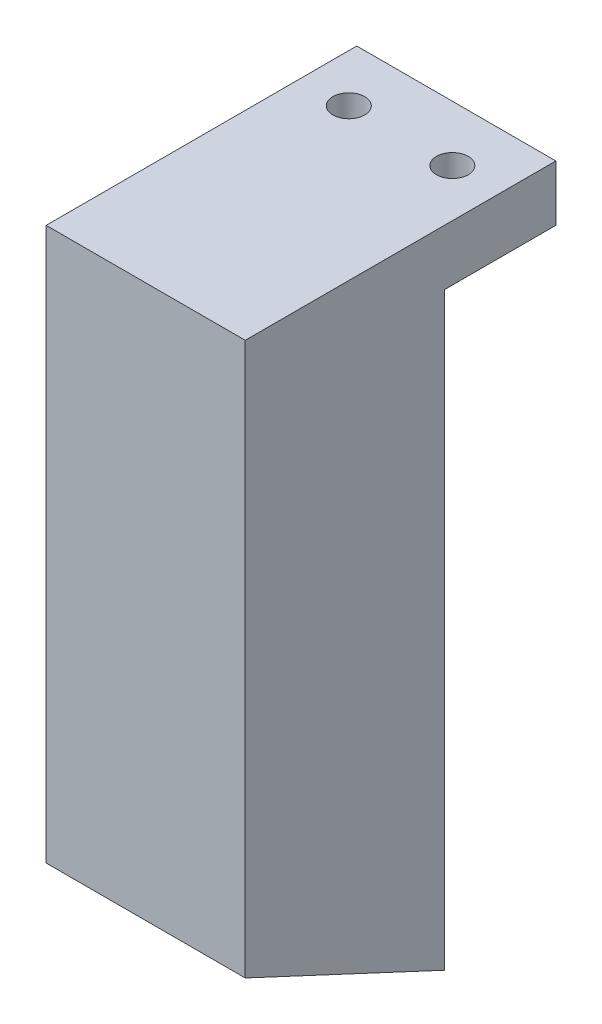
from build123d import *

# Parameters (mm, degrees)
SKETCH1_W           = 25
SKETCH1_H           = 25
BOSS_EXTRUDE1_DEPTH = 81
CUT_EXTRUDE1_DEPTH  = 40
SKETCH3_R           = 1.5
CUT_EXTRUDE2_DEPTH  = 36
SKETCH4_W           = 25
SKETCH4_H           = 7
BOSS_EXTRUDE2_DEPTH = 14
SKETCH5_R           = 2
CUT_EXTRUDE3_DEPTH  = 14


with BuildPart() as part:
    # Sketch1 → Boss-Extrude1 (new body)
    with BuildSketch(Plane(origin=(0, 0, 0), x_dir=(1, 0, 0), z_dir=(0, 1, 0))):
        with Locations((-64.404761905, 3.571428571)):
            Rectangle(SKETCH1_W, SKETCH1_H)
    extrude(amount=BOSS_EXTRUDE1_DEPTH)

    # Sketch2 → Cut-Extrude1 (cut)
    with BuildSketch(Plane(origin=(-51.904761905, 0, 0), x_dir=(0, 0, -1), z_dir=(1, 0, 0))):
        Polygon((16.071428571, 0), (-8.928571429, 0), (-8.928571429, 11.657691454), align=None)
    extrude(amount=-CUT_EXTRUDE1_DEPTH, mode=Mode.SUBTRACT)

    # Sketch3 → Cut-Extrude2 (cut)
    with BuildSketch(Plane(origin=(0, 6.155714275, -2.870456708), x_dir=(1, 0, 0), z_dir=(0, -0.9063077870366528, 0.4226182617406934))):
        with Locations(Location((-64.404761905, -0.771212889, 0), (0, 0, 270))):
            Circle(SKETCH3_R)
    extrude(amount=-CUT_EXTRUDE2_DEPTH, mode=Mode.SUBTRACT)

    # Sketch4 → Boss-Extrude2 (add)
    with BuildSketch(Plane(origin=(0, 0, -16.071428571), x_dir=(-1, 0, 0), z_dir=(0, 0, -1))):
        with Locations((64.404761905, 77.5)):
            Rectangle(SKETCH4_W, SKETCH4_H)
    extrude(amount=BOSS_EXTRUDE2_DEPTH)

    # Sketch5 → Cut-Extrude3 (cut)
    with BuildSketch(Plane(origin=(0, 74, 0), x_dir=(-1, 0, 0), z_dir=(0, -1, 0))):
        with Locations(Location((70.904761905, 23.071428571, 0), (0, 0, 90))):
            Circle(SKETCH5_R)
        with Locations(Location((57.904761905, 23.071428571, 0), (0, 0, 90))):
            Circle(SKETCH5_R)
    extrude(amount=-CUT_EXTRUDE3_DEPTH, mode=Mode.SUBTRACT)


solid = part.part
